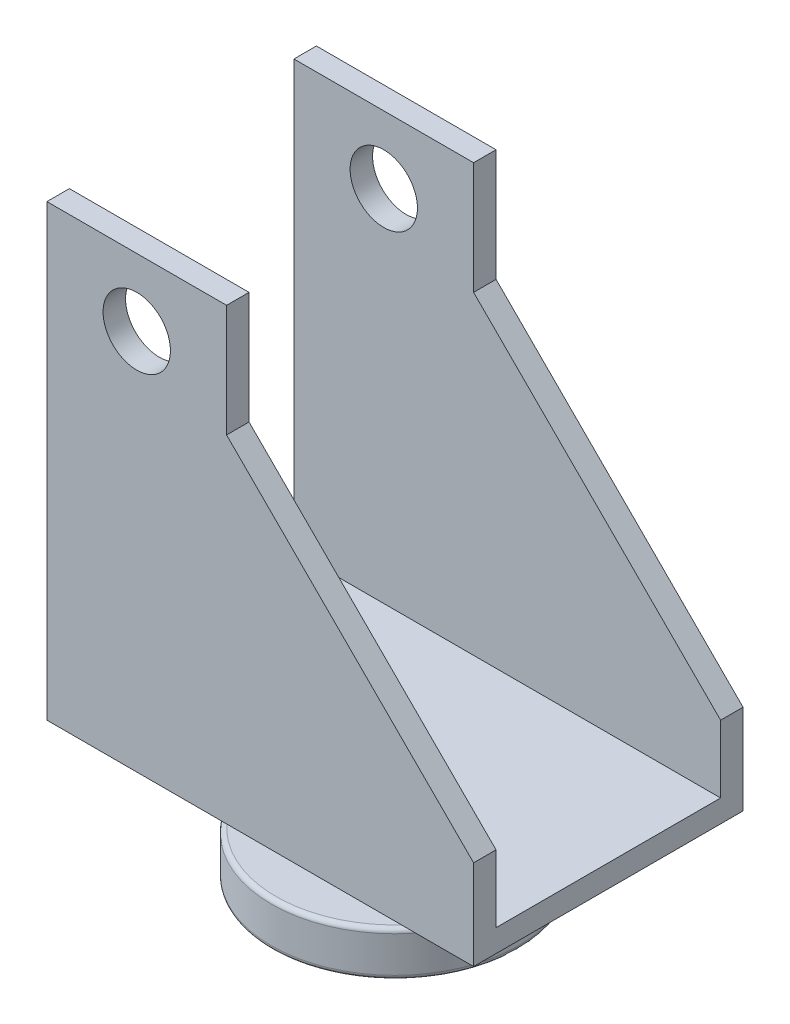
from build123d import *

# Parameters (mm, degrees)
BOSS_EXTRUDE1_DEPTH     = 30
SHELL1_T                = -5
CUT_EXTRUDE1_DEPTH      = 142.155942135
CUT_EXTRUDE1_DEPTH_BACK = 142.155942135
SKETCH1_3_R             = 7.5
SKETCH2_R               = 15
BOSS_EXTRUDE2_DEPTH     = 12
SKETCH3_R               = 27.5
BOSS_EXTRUDE3_DEPTH     = 10
FILLET1_R               = 1


with BuildPart() as part:
    # Sketch1 → Boss-Extrude1 (new, symmetric)
    with BuildSketch(Plane.XY):
        Polygon((0, 100), (0, 0), (95, 0), (95, 20), (40, 75), (40, 100), align=None)
    extrude(amount=BOSS_EXTRUDE1_DEPTH, both=True)

    # Shell1
    shell1_openings = [part.faces().sort_by_distance(p)[0] for p in [
        (0, 50, 0),
        (95, 10, 0),
        (40, 87.5, 0),
        (20, 100, 0),
        (67.5, 47.5, 0),
    ]]
    offset(amount=SHELL1_T, openings=shell1_openings, kind=Kind.INTERSECTION)

    # Sketch1<3> → Cut-Extrude1 (cut, two sides: drawn at the far end of the back side and taken through both)
    with BuildSketch(Plane.XY.offset(-CUT_EXTRUDE1_DEPTH_BACK)):
        with Locations((20, 85)):
            Circle(SKETCH1_3_R)
    extrude(amount=CUT_EXTRUDE1_DEPTH + CUT_EXTRUDE1_DEPTH_BACK, mode=Mode.SUBTRACT)

    # Sketch2 → Boss-Extrude2 (add)
    with BuildSketch(Plane.XZ):
        with Locations((47.5, 0)):
            Circle(SKETCH2_R)
    extrude(amount=BOSS_EXTRUDE2_DEPTH)

    # Sketch3 → Boss-Extrude3 (add)
    with BuildSketch(Plane.XZ.offset(12)):
        with Locations((47.5, 0)):
            Circle(SKETCH3_R)
    extrude(amount=BOSS_EXTRUDE3_DEPTH)

    # Fillet1
    fillet1_edges = [part.edges().sort_by_distance(p)[0] for p in [
        (20, -22, 0),
        (20, -12, 0),
    ]]
    fillet(fillet1_edges, radius=FILLET1_R)


solid = part.part
